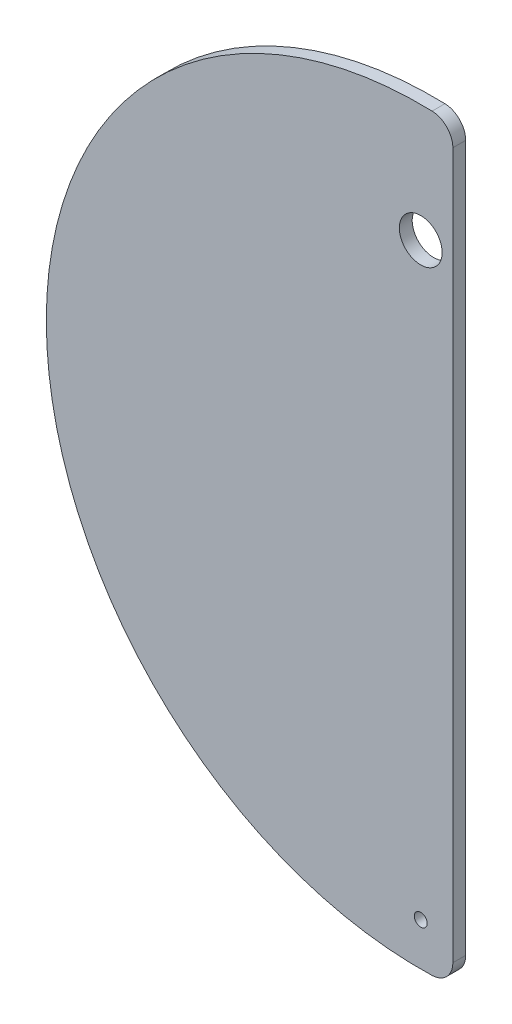
from build123d import *

# Parameters (mm, degrees)
SKETCH1_R           = 10
SKETCH1_R_2         = 3
BOSS_EXTRUDE1_DEPTH = 6
FILLET1_R           = 10


with BuildPart() as part:
    # Sketch1 → Boss-Extrude1 (new body)
    with BuildSketch(Plane.XY):
        with BuildLine():
            Line((15, 174.355957742), (15, -174.355957742))
            ThreePointArc((15, -174.355957742), (-175, 0), (15, 174.355957742))
        make_face()
        with Locations((0, 120)):
            Circle(SKETCH1_R, mode=Mode.SUBTRACT)
        with Locations((0, -155)):
            Circle(SKETCH1_R_2, mode=Mode.SUBTRACT)
    extrude(amount=BOSS_EXTRUDE1_DEPTH)

    # Fillet1
    fillet1_edges = [part.edges().sort_by_distance(p)[0] for p in [
        (15, 174.355957742, 3),
        (15, -174.355957742, 3),
    ]]
    fillet(fillet1_edges, radius=FILLET1_R)


solid = part.part
